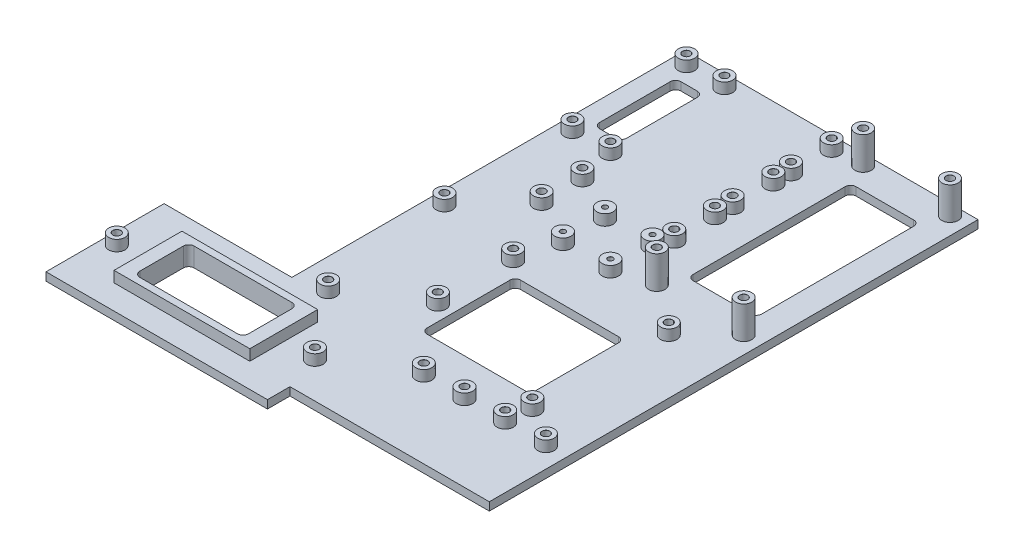
from build123d import *

# Parameters (mm, degrees)
SKETCH1_W                            = 155
SKETCH1_H                            = 180
BOSS_EXTRUDE1_DEPTH                  = 1
SKETCH2_W                            = 47.07
SKETCH2_H                            = 144.795
CUT_EXTRUDE1_DEPTH                   = 1
SKETCH3_W                            = 81.57
SKETCH3_H                            = 8.295
BOSS_EXTRUDE2_DEPTH                  = 1
SKETCH4_R                            = 3
BOSS_EXTRUDE3_DEPTH                  = 4
SKETCH5_R                            = 3
BOSS_EXTRUDE4_DEPTH                  = 8
BOSS_EXTRUDE5_DEPTH                  = 2
F_2_9_2_9_DIAMETER_HOLE2_AT_2_COUNT  = 2
F_2_9_2_9_DIAMETER_HOLE2_AT_2_PITCH  = 15
F_2_9_2_9_DIAMETER_HOLE2_AT_3_COUNT  = 2
F_2_9_2_9_DIAMETER_HOLE2_AT_3_PITCH  = 30
F_2_9_2_9_DIAMETER_HOLE2_AT_4_COUNT  = 2
F_2_9_2_9_DIAMETER_HOLE2_AT_4_PITCH  = 45
F_2_9_2_9_DIAMETER_HOLE2_AT_5_COUNT  = 2
F_2_9_2_9_DIAMETER_HOLE2_AT_5_PITCH  = 66.393302373
F_2_9_2_9_DIAMETER_HOLE2_AT_6_COUNT  = 2
F_2_9_2_9_DIAMETER_HOLE2_AT_6_PITCH  = 111.192522231
F_2_9_2_9_DIAMETER_HOLE2_AT_7_COUNT  = 2
F_2_9_2_9_DIAMETER_HOLE2_AT_7_PITCH  = 116.520457431
F_2_9_2_9_DIAMETER_HOLE2_AT_8_COUNT  = 2
F_2_9_2_9_DIAMETER_HOLE2_AT_8_PITCH  = 151.510187776
F_2_9_2_9_DIAMETER_HOLE2_AT_9_COUNT  = 2
F_2_9_2_9_DIAMETER_HOLE2_AT_9_PITCH  = 155.462461707
F_2_9_2_9_DIAMETER_HOLE2_AT_10_COUNT = 2
F_2_9_2_9_DIAMETER_HOLE2_AT_10_PITCH = 146.879821623
F_2_9_2_9_DIAMETER_HOLE2_AT_11_COUNT = 2
F_2_9_2_9_DIAMETER_HOLE2_AT_11_PITCH = 131.884350853
F_2_9_2_9_DIAMETER_HOLE2_AT_12_COUNT = 2
F_2_9_2_9_DIAMETER_HOLE2_AT_12_PITCH = 125.386650007
F_2_9_2_9_DIAMETER_HOLE2_AT_13_COUNT = 2
F_2_9_2_9_DIAMETER_HOLE2_AT_13_PITCH = 110.392988908
F_2_9_2_9_DIAMETER_HOLE2_AT_14_COUNT = 2
F_2_9_2_9_DIAMETER_HOLE2_AT_14_PITCH = 103.896304073
F_2_9_2_9_DIAMETER_HOLE2_AT_15_COUNT = 2
F_2_9_2_9_DIAMETER_HOLE2_AT_15_PITCH = 88.905804085
F_2_9_2_9_DIAMETER_HOLE2_AT_16_COUNT = 2
F_2_9_2_9_DIAMETER_HOLE2_AT_16_PITCH = 29.223387894
F_2_9_2_9_DIAMETER_HOLE2_AT_17_COUNT = 2
F_2_9_2_9_DIAMETER_HOLE2_AT_17_PITCH = 99.220393065
F_2_9_2_9_DIAMETER_HOLE2_AT_18_COUNT = 2
F_2_9_2_9_DIAMETER_HOLE2_AT_18_PITCH = 45.163969046
F_2_9_2_9_DIAMETER_HOLE2_AT_19_COUNT = 2
F_2_9_2_9_DIAMETER_HOLE2_AT_19_PITCH = 76.972060515
F_2_9_2_9_DIAMETER_HOLE2_AT_20_COUNT = 2
F_2_9_2_9_DIAMETER_HOLE2_AT_20_PITCH = 32.243202384
F_2_9_2_9_DIAMETER_HOLE2_AT_21_COUNT = 2
F_2_9_2_9_DIAMETER_HOLE2_AT_21_PITCH = 148.50139932
F_2_9_2_9_DIAMETER_HOLE2_AT_22_COUNT = 2
F_2_9_2_9_DIAMETER_HOLE2_AT_22_PITCH = 73.191431192
F_2_9_2_9_DIAMETER_HOLE2_AT_23_COUNT = 2
F_2_9_2_9_DIAMETER_HOLE2_AT_23_PITCH = 85.305249545
F_2_9_2_9_DIAMETER_HOLE2_AT_24_COUNT = 2
F_2_9_2_9_DIAMETER_HOLE2_AT_24_PITCH = 154.831087318
F_2_9_2_9_DIAMETER_HOLE2_AT_25_COUNT = 2
F_2_9_2_9_DIAMETER_HOLE2_AT_25_PITCH = 97.296127364
F_2_9_2_9_DIAMETER_HOLE2_AT_26_COUNT = 2
F_2_9_2_9_DIAMETER_HOLE2_AT_26_PITCH = 83.345884122
F_2_9_2_9_DIAMETER_HOLE2_AT_27_COUNT = 2
F_2_9_2_9_DIAMETER_HOLE2_AT_27_PITCH = 56.656355336
F_2_9_2_9_DIAMETER_HOLE2_AT_28_COUNT = 2
F_2_9_2_9_DIAMETER_HOLE2_AT_28_PITCH = 32.234455168
F_1_9_1_9_DIAMETER_HOLE1_D           = 1.9
F_1_9_1_9_DIAMETER_HOLE1_CSINK_D     = 1.95
F_1_9_1_9_DIAMETER_HOLE1_CSINK_ANGLE = 90
F_2_9_2_9_DIAMETER_HOLE1_D           = 2.9
F_2_9_2_9_DIAMETER_HOLE1_CSINK_D     = 2.95
F_2_9_2_9_DIAMETER_HOLE1_CSINK_ANGLE = 90
SKETCH18_W                           = 40
SKETCH18_H                           = 20
SKETCH18_H_2                         = 34.470588236
SKETCH18_W_2                         = 25.263157894
SKETCH18_H_3                         = 60
SKETCH18_W_3                         = 10
SKETCH18_H_4                         = 30
CUT_EXTRUDE2_DEPTH                   = 126.74639965
FILLET1_R                            = 2
SKETCH19_W                           = 50
SKETCH19_H                           = 25
BOSS_EXTRUDE6_DEPTH                  = 4
CUT_EXTRUDE3_DEPTH                   = 10


with BuildPart() as part:
    # Sketch1 → Boss-Extrude1 (new body)
    with BuildSketch(Plane(origin=(0, 0, 0), x_dir=(1, 0, 0), z_dir=(0, 1, 0))):
        Rectangle(SKETCH1_W, SKETCH1_H)
    extrude(amount=BOSS_EXTRUDE1_DEPTH)

    # Sketch2 → Cut-Extrude1 (cut)
    with BuildSketch(Plane(origin=(0, 1, 0), x_dir=(1, 0, 0), z_dir=(0, 1, 0))):
        with Locations((-53.965, 17.6025)):
            Rectangle(SKETCH2_W, SKETCH2_H)
    extrude(amount=-CUT_EXTRUDE1_DEPTH, mode=Mode.SUBTRACT)

    # Sketch3 → Boss-Extrude2 (add)
    with BuildSketch(Plane(origin=(0, 1, 0), x_dir=(1, 0, 0), z_dir=(0, 1, 0))):
        with Locations((-36.715, -94.1475)):
            Rectangle(SKETCH3_W, SKETCH3_H)
    extrude(amount=-BOSS_EXTRUDE2_DEPTH)

    # Sketch4 → Boss-Extrude3 (add)
    with BuildSketch(Plane(origin=(0, 1, 0), x_dir=(1, 0, 0), z_dir=(0, 1, 0))):
        with Locations(Location((-25.18, 85.295, 0), (0, 0, 270))):
            Circle(SKETCH4_R)
        with Locations(Location((-11.18, 85.295, 0), (0, 0, 270))):
            Circle(SKETCH4_R)
        with Locations(Location((-11.18, 43.295, 0), (0, 0, 270))):
            Circle(SKETCH4_R)
        with Locations(Location((-25.18, 43.295, 0), (0, 0, 270))):
            Circle(SKETCH4_R)
        with Locations(Location((-7.93, 29.705, 0), (0, 0, 270))):
            Circle(SKETCH4_R)
        with Locations(Location((-7.93, 14.705, 0), (0, 0, 270))):
            Circle(SKETCH4_R)
        with Locations(Location((0.07, -76.795, 0), (0, 0, 270))):
            Circle(SKETCH4_R)
        with Locations(Location((-72.93, -76.795, 0), (0, 0, 270))):
            Circle(SKETCH4_R)
        with Locations(Location((25.15, -61.795, 0), (0, 0, 270))):
            Circle(SKETCH4_R)
        with Locations(Location((40.15, -61.795, 0), (0, 0, 270))):
            Circle(SKETCH4_R)
        with Locations(Location((55.15, -61.795, 0), (0, 0, 270))):
            Circle(SKETCH4_R)
        with Locations(Location((70.15, -61.795, 0), (0, 0, 270))):
            Circle(SKETCH4_R)
        with Locations(Location((5.1, -8.805, 0), (0, 0, 270))):
            Circle(SKETCH4_R)
        with Locations(Location((5.1, -36.555, 0), (0, 0, 270))):
            Circle(SKETCH4_R)
        with Locations(Location((56.1, -52.755, 0), (0, 0, 270))):
            Circle(SKETCH4_R)
        with Locations(Location((57.3, -3.705, 0), (0, 0, 270))):
            Circle(SKETCH4_R)
        with Locations(Location((26.32, 5.795, 0), (0, 0, 270))):
            Circle(SKETCH4_R)
        with Locations(Location((8.82, 5.795, 0), (0, 0, 270))):
            Circle(SKETCH4_R)
        with Locations(Location((8.82, 21.295, 0), (0, 0, 270))):
            Circle(SKETCH4_R)
        with Locations(Location((26.32, 21.295, 0), (0, 0, 270))):
            Circle(SKETCH4_R)
        with Locations(Location((28.57, 27.045, 0), (0, 0, 270))):
            Circle(SKETCH4_R)
        with Locations(Location((28.57, 42.045, 0), (0, 0, 270))):
            Circle(SKETCH4_R)
        with Locations(Location((28.57, 48.545, 0), (0, 0, 270))):
            Circle(SKETCH4_R)
        with Locations(Location((28.57, 63.545, 0), (0, 0, 270))):
            Circle(SKETCH4_R)
        with Locations(Location((28.57, 70.045, 0), (0, 0, 270))):
            Circle(SKETCH4_R)
        with Locations(Location((28.57, 85.045, 0), (0, 0, 270))):
            Circle(SKETCH4_R)
        with Locations(Location((39.15, 86.045, 0), (0, 0, 270))):
            Circle(SKETCH4_R)
        with Locations(Location((71.15, 86.045, 0), (0, 0, 270))):
            Circle(SKETCH4_R)
        with Locations(Location((71.15, 10.045, 0), (0, 0, 270))):
            Circle(SKETCH4_R)
        with Locations(Location((39.15, 10.045, 0), (0, 0, 270))):
            Circle(SKETCH4_R)
        with Locations(Location((-25.35, -3.705, 0), (0, 0, 270))):
            Circle(SKETCH4_R)
        with Locations(Location((-19.1, -52.755, 0), (0, 0, 270))):
            Circle(SKETCH4_R)
    extrude(amount=BOSS_EXTRUDE3_DEPTH)

    # Sketch5 → Boss-Extrude4 (add)
    with BuildSketch(Plane(origin=(0, 5, 0), x_dir=(1, 0, 0), z_dir=(0, 1, 0))):
        with Locations(Location((71.15, 10.045, 0), (0, 0, 270))):
            Circle(SKETCH5_R)
        with Locations(Location((39.15, 10.045, 0), (0, 0, 270))):
            Circle(SKETCH5_R)
        with Locations(Location((39.15, 86.045, 0), (0, 0, 270))):
            Circle(SKETCH5_R)
        with Locations(Location((71.15, 86.045, 0), (0, 0, 270))):
            Circle(SKETCH5_R)
    extrude(amount=BOSS_EXTRUDE4_DEPTH)

    # Sketch6 → Boss-Extrude5 (add)
    with BuildSketch(Plane.XZ):
        Polygon((-77.5, 54.795), (-30.43, 54.795), (-30.43, -90), (77.5, -90), (77.5, 90), (4.07, 90), (4.07, 98.295), (-77.5, 98.295), align=None)
    extrude(amount=BOSS_EXTRUDE5_DEPTH)

    # Sketch12 → Ø2.9 (2.9) Diameter Hole2 (revolve, cut)
    with BuildSketch(Plane(origin=(25.15, 5, 61.795), x_dir=(0, 0, 1), z_dir=(1, 0, 0))):
        Polygon((0, 0), (0, 7), (1.45, 7), (1.45, 0.025), (1.475, 0), align=None)
    f_2_9_2_9_diameter_hole2 = revolve(axis=Axis((25.15, 11.35, 61.795), (0, -1, 0)), mode=Mode.SUBTRACT)

    # Ø2.9 (2.9) Diameter Hole2 at 2: Ø2.9 (2.9) Diameter Hole2 ×2
    with Locations(*[(i * F_2_9_2_9_DIAMETER_HOLE2_AT_2_PITCH, 0, 0) for i in range(1, F_2_9_2_9_DIAMETER_HOLE2_AT_2_COUNT)]):
        add(f_2_9_2_9_diameter_hole2, mode=Mode.SUBTRACT)

    # Ø2.9 (2.9) Diameter Hole2 at 3: Ø2.9 (2.9) Diameter Hole2 ×2
    with Locations(*[(i * F_2_9_2_9_DIAMETER_HOLE2_AT_3_PITCH, 0, 0) for i in range(1, F_2_9_2_9_DIAMETER_HOLE2_AT_3_COUNT)]):
        add(f_2_9_2_9_diameter_hole2, mode=Mode.SUBTRACT)

    # Ø2.9 (2.9) Diameter Hole2 at 4: Ø2.9 (2.9) Diameter Hole2 ×2
    with Locations(*[(i * F_2_9_2_9_DIAMETER_HOLE2_AT_4_PITCH, 0, 0) for i in range(1, F_2_9_2_9_DIAMETER_HOLE2_AT_4_COUNT)]):
        add(f_2_9_2_9_diameter_hole2, mode=Mode.SUBTRACT)

    # Ø2.9 (2.9) Diameter Hole2 at 5: Ø2.9 (2.9) Diameter Hole2 ×2
    with Locations(*[Vector(0.48423559080332107, 0, -0.8749376506925272) * (i * F_2_9_2_9_DIAMETER_HOLE2_AT_5_PITCH) for i in range(1, F_2_9_2_9_DIAMETER_HOLE2_AT_5_COUNT)]):
        add(f_2_9_2_9_diameter_hole2, mode=Mode.SUBTRACT)

    # Ø2.9 (2.9) Diameter Hole2 at 6: Ø2.9 (2.9) Diameter Hole2 ×2
    with Locations(*[Vector(-0.3267306044615087, 0, -0.9451175123275503) * (i * F_2_9_2_9_DIAMETER_HOLE2_AT_6_PITCH) for i in range(1, F_2_9_2_9_DIAMETER_HOLE2_AT_6_COUNT)]):
        add(f_2_9_2_9_diameter_hole2, mode=Mode.SUBTRACT)

    # Ø2.9 (2.9) Diameter Hole2 at 7: Ø2.9 (2.9) Diameter Hole2 ×2
    with Locations(*[Vector(-0.4319413183704097, 0, -0.9019017116540097) * (i * F_2_9_2_9_DIAMETER_HOLE2_AT_7_PITCH) for i in range(1, F_2_9_2_9_DIAMETER_HOLE2_AT_7_COUNT)]):
        add(f_2_9_2_9_diameter_hole2, mode=Mode.SUBTRACT)

    # Ø2.9 (2.9) Diameter Hole2 at 8: Ø2.9 (2.9) Diameter Hole2 ×2
    with Locations(*[Vector(-0.23978585554687462, 0, -0.9708258049102596) * (i * F_2_9_2_9_DIAMETER_HOLE2_AT_8_PITCH) for i in range(1, F_2_9_2_9_DIAMETER_HOLE2_AT_8_COUNT)]):
        add(f_2_9_2_9_diameter_hole2, mode=Mode.SUBTRACT)

    # Ø2.9 (2.9) Diameter Hole2 at 9: Ø2.9 (2.9) Diameter Hole2 ×2
    with Locations(*[Vector(-0.3237437478306334, 0, -0.9461448016770876) * (i * F_2_9_2_9_DIAMETER_HOLE2_AT_9_PITCH) for i in range(1, F_2_9_2_9_DIAMETER_HOLE2_AT_9_COUNT)]):
        add(f_2_9_2_9_diameter_hole2, mode=Mode.SUBTRACT)

    # Ø2.9 (2.9) Diameter Hole2 at 10: Ø2.9 (2.9) Diameter Hole2 ×2
    with Locations(*[Vector(0.023284342002936977, 0, -0.9997288829565195) * (i * F_2_9_2_9_DIAMETER_HOLE2_AT_10_PITCH) for i in range(1, F_2_9_2_9_DIAMETER_HOLE2_AT_10_COUNT)]):
        add(f_2_9_2_9_diameter_hole2, mode=Mode.SUBTRACT)

    # Ø2.9 (2.9) Diameter Hole2 at 11: Ø2.9 (2.9) Diameter Hole2 ×2
    with Locations(*[Vector(0.025931810543646808, 0, -0.9996637140568465) * (i * F_2_9_2_9_DIAMETER_HOLE2_AT_11_PITCH) for i in range(1, F_2_9_2_9_DIAMETER_HOLE2_AT_11_COUNT)]):
        add(f_2_9_2_9_diameter_hole2, mode=Mode.SUBTRACT)

    # Ø2.9 (2.9) Diameter Hole2 at 12: Ø2.9 (2.9) Diameter Hole2 ×2
    with Locations(*[Vector(0.027275631016592573, 0, -0.9996279507660071) * (i * F_2_9_2_9_DIAMETER_HOLE2_AT_12_PITCH) for i in range(1, F_2_9_2_9_DIAMETER_HOLE2_AT_12_COUNT)]):
        add(f_2_9_2_9_diameter_hole2, mode=Mode.SUBTRACT)

    # Ø2.9 (2.9) Diameter Hole2 at 13: Ø2.9 (2.9) Diameter Hole2 ×2
    with Locations(*[Vector(0.030980228308303416, 0, -0.9995199975257951) * (i * F_2_9_2_9_DIAMETER_HOLE2_AT_13_PITCH) for i in range(1, F_2_9_2_9_DIAMETER_HOLE2_AT_13_COUNT)]):
        add(f_2_9_2_9_diameter_hole2, mode=Mode.SUBTRACT)

    # Ø2.9 (2.9) Diameter Hole2 at 14: Ø2.9 (2.9) Diameter Hole2 ×2
    with Locations(*[Vector(0.032917436577932876, 0, -0.9994580743428599) * (i * F_2_9_2_9_DIAMETER_HOLE2_AT_14_PITCH) for i in range(1, F_2_9_2_9_DIAMETER_HOLE2_AT_14_COUNT)]):
        add(f_2_9_2_9_diameter_hole2, mode=Mode.SUBTRACT)

    # Ø2.9 (2.9) Diameter Hole2 at 15: Ø2.9 (2.9) Diameter Hole2 ×2
    with Locations(*[Vector(0.03846767975609684, 0, -0.9992598448922995) * (i * F_2_9_2_9_DIAMETER_HOLE2_AT_15_PITCH) for i in range(1, F_2_9_2_9_DIAMETER_HOLE2_AT_15_COUNT)]):
        add(f_2_9_2_9_diameter_hole2, mode=Mode.SUBTRACT)

    # Ø2.9 (2.9) Diameter Hole2 at 16: Ø2.9 (2.9) Diameter Hole2 ×2
    with Locations(*[Vector(-0.858216716385444, 0, 0.5132875097999041) * (i * F_2_9_2_9_DIAMETER_HOLE2_AT_16_PITCH) for i in range(1, F_2_9_2_9_DIAMETER_HOLE2_AT_16_COUNT)]):
        add(f_2_9_2_9_diameter_hole2, mode=Mode.SUBTRACT)

    # Ø2.9 (2.9) Diameter Hole2 at 17: Ø2.9 (2.9) Diameter Hole2 ×2
    with Locations(*[Vector(-0.988506464952352, 0, 0.15117859884059154) * (i * F_2_9_2_9_DIAMETER_HOLE2_AT_17_PITCH) for i in range(1, F_2_9_2_9_DIAMETER_HOLE2_AT_17_COUNT)]):
        add(f_2_9_2_9_diameter_hole2, mode=Mode.SUBTRACT)

    # Ø2.9 (2.9) Diameter Hole2 at 18: Ø2.9 (2.9) Diameter Hole2 ×2
    with Locations(*[Vector(-0.9797633143092743, 0, -0.20015955618882234) * (i * F_2_9_2_9_DIAMETER_HOLE2_AT_18_PITCH) for i in range(1, F_2_9_2_9_DIAMETER_HOLE2_AT_18_COUNT)]):
        add(f_2_9_2_9_diameter_hole2, mode=Mode.SUBTRACT)

    # Ø2.9 (2.9) Diameter Hole2 at 19: Ø2.9 (2.9) Diameter Hole2 ×2
    with Locations(*[Vector(-0.656082215570137, 0, -0.7546894238112658) * (i * F_2_9_2_9_DIAMETER_HOLE2_AT_19_PITCH) for i in range(1, F_2_9_2_9_DIAMETER_HOLE2_AT_19_COUNT)]):
        add(f_2_9_2_9_diameter_hole2, mode=Mode.SUBTRACT)

    # Ø2.9 (2.9) Diameter Hole2 at 20: Ø2.9 (2.9) Diameter Hole2 ×2
    with Locations(*[Vector(0.9598922473964604, 0, -0.2803691733913921) * (i * F_2_9_2_9_DIAMETER_HOLE2_AT_20_PITCH) for i in range(1, F_2_9_2_9_DIAMETER_HOLE2_AT_20_COUNT)]):
        add(f_2_9_2_9_diameter_hole2, mode=Mode.SUBTRACT)

    # Ø2.9 (2.9) Diameter Hole2 at 21: Ø2.9 (2.9) Diameter Hole2 ×2
    with Locations(*[Vector(0.09427520591796769, 0, -0.9955461744937424) * (i * F_2_9_2_9_DIAMETER_HOLE2_AT_21_PITCH) for i in range(1, F_2_9_2_9_DIAMETER_HOLE2_AT_21_COUNT)]):
        add(f_2_9_2_9_diameter_hole2, mode=Mode.SUBTRACT)

    # Ø2.9 (2.9) Diameter Hole2 at 22: Ø2.9 (2.9) Diameter Hole2 ×2
    with Locations(*[Vector(0.19127922178741333, 0, -0.9815356638005578) * (i * F_2_9_2_9_DIAMETER_HOLE2_AT_22_PITCH) for i in range(1, F_2_9_2_9_DIAMETER_HOLE2_AT_22_COUNT)]):
        add(f_2_9_2_9_diameter_hole2, mode=Mode.SUBTRACT)

    # Ø2.9 (2.9) Diameter Hole2 at 23: Ø2.9 (2.9) Diameter Hole2 ×2
    with Locations(*[Vector(0.5392399675887218, 0, -0.8421521580776922) * (i * F_2_9_2_9_DIAMETER_HOLE2_AT_23_PITCH) for i in range(1, F_2_9_2_9_DIAMETER_HOLE2_AT_23_COUNT)]):
        add(f_2_9_2_9_diameter_hole2, mode=Mode.SUBTRACT)

    # Ø2.9 (2.9) Diameter Hole2 at 24: Ø2.9 (2.9) Diameter Hole2 ×2
    with Locations(*[Vector(0.2970979587942434, 0, -0.9548470049595873) * (i * F_2_9_2_9_DIAMETER_HOLE2_AT_24_PITCH) for i in range(1, F_2_9_2_9_DIAMETER_HOLE2_AT_24_COUNT)]):
        add(f_2_9_2_9_diameter_hole2, mode=Mode.SUBTRACT)

    # Ø2.9 (2.9) Diameter Hole2 at 25: Ø2.9 (2.9) Diameter Hole2 ×2
    with Locations(*[Vector(-0.33999297707192394, 0, -0.9404279746699213) * (i * F_2_9_2_9_DIAMETER_HOLE2_AT_25_PITCH) for i in range(1, F_2_9_2_9_DIAMETER_HOLE2_AT_25_COUNT)]):
        add(f_2_9_2_9_diameter_hole2, mode=Mode.SUBTRACT)

    # Ø2.9 (2.9) Diameter Hole2 at 26: Ø2.9 (2.9) Diameter Hole2 ×2
    with Locations(*[Vector(-0.39690022307236633, 0, -0.917861761337243) * (i * F_2_9_2_9_DIAMETER_HOLE2_AT_26_PITCH) for i in range(1, F_2_9_2_9_DIAMETER_HOLE2_AT_26_COUNT)]):
        add(f_2_9_2_9_diameter_hole2, mode=Mode.SUBTRACT)

    # Ø2.9 (2.9) Diameter Hole2 at 27: Ø2.9 (2.9) Diameter Hole2 ×2
    with Locations(*[Vector(-0.35388792450495815, 0, -0.9352878363849138) * (i * F_2_9_2_9_DIAMETER_HOLE2_AT_27_PITCH) for i in range(1, F_2_9_2_9_DIAMETER_HOLE2_AT_27_COUNT)]):
        add(f_2_9_2_9_diameter_hole2, mode=Mode.SUBTRACT)

    # Ø2.9 (2.9) Diameter Hole2 at 28: Ø2.9 (2.9) Diameter Hole2 ×2
    with Locations(*[Vector(-0.6220052392785671, 0, -0.7830130792713571) * (i * F_2_9_2_9_DIAMETER_HOLE2_AT_28_PITCH) for i in range(1, F_2_9_2_9_DIAMETER_HOLE2_AT_28_COUNT)]):
        add(f_2_9_2_9_diameter_hole2, mode=Mode.SUBTRACT)

    # Ø1.9 (1.9) Diameter Hole1 (through all)
    with Locations(Plane(origin=(0, 5, 0), x_dir=(1, 0, 0), z_dir=(0, 1, 0))):
        with Locations((8.82, 21.295), (26.32, 21.295), (26.32, 5.795), (8.82, 5.795)):
            CounterSinkHole(F_1_9_1_9_DIAMETER_HOLE1_D / 2, F_1_9_1_9_DIAMETER_HOLE1_CSINK_D / 2, counter_sink_angle=F_1_9_1_9_DIAMETER_HOLE1_CSINK_ANGLE)

    # Ø2.9 (2.9) Diameter Hole1 (through all)
    with Locations(Plane(origin=(0, 13, 0), x_dir=(1, 0, 0), z_dir=(0, 1, 0))):
        with Locations((71.15, 86.045), (39.15, 86.045), (39.15, 10.045), (71.15, 10.045)):
            CounterSinkHole(F_2_9_2_9_DIAMETER_HOLE1_D / 2, F_2_9_2_9_DIAMETER_HOLE1_CSINK_D / 2, counter_sink_angle=F_2_9_2_9_DIAMETER_HOLE1_CSINK_ANGLE)

    # Sketch18 → Cut-Extrude2 (cut, through all)
    with BuildSketch(Plane(origin=(0, 1, 0), x_dir=(1, 0, 0), z_dir=(0, 1, 0))):
        with Locations((-36.43, -76.795)):
            Rectangle(SKETCH18_W, SKETCH18_H)
        with Locations((30.6, -30.78)):
            Rectangle(SKETCH18_W, SKETCH18_H_2)
        with Locations((55.15, 48.045)):
            Rectangle(SKETCH18_W_2, SKETCH18_H_3)
        with Locations((-18.18, 64.295)):
            Rectangle(SKETCH18_W_3, SKETCH18_H_4)
    extrude(amount=-CUT_EXTRUDE2_DEPTH, mode=Mode.SUBTRACT)

    # Fillet1
    fillet1_edges = [part.edges().sort_by_distance(p)[0] for p in [
        (-16.43, -0.5, 66.795),
        (-16.43, -0.5, 86.795),
        (-56.43, -0.5, 86.795),
        (-56.43, -0.5, 66.795),
        (50.6, -0.5, 13.544705882),
        (50.6, -0.5, 48.015294118),
        (10.6, -0.5, 48.015294118),
        (10.6, -0.5, 13.544705882),
        (67.781578947, -0.5, -78.045),
        (67.781578947, -0.5, -18.045),
        (42.518421053, -0.5, -18.045),
        (42.518421053, -0.5, -78.045),
        (-13.18, -0.5, -79.295),
        (-13.18, -0.5, -49.295),
        (-23.18, -0.5, -49.295),
        (-23.18, -0.5, -79.295),
    ]]
    fillet(fillet1_edges, radius=FILLET1_R)

    # Sketch19 → Boss-Extrude6 (add)
    with BuildSketch(Plane(origin=(0, 1, 0), x_dir=(1, 0, 0), z_dir=(0, 1, 0))):
        with Locations((-36.43, -76.795)):
            Rectangle(SKETCH19_W, SKETCH19_H)
    extrude(amount=BOSS_EXTRUDE6_DEPTH)

    # Sketch20 → Cut-Extrude3 (cut)
    with BuildSketch(Plane.XZ.offset(-1)):
        with BuildLine():
            Line((-56.43, 84.795), (-56.43, 68.795))
            ThreePointArc((-56.43, 68.795), (-55.844213562, 67.380786438), (-54.43, 66.795))
            Line((-54.43, 66.795), (-18.43, 66.795))
            ThreePointArc((-18.43, 66.795), (-17.015786438, 67.380786438), (-16.43, 68.795))
            Line((-16.43, 68.795), (-16.43, 84.795))
            ThreePointArc((-16.43, 84.795), (-17.015786438, 86.209213562), (-18.43, 86.795))
            Line((-18.43, 86.795), (-54.43, 86.795))
            ThreePointArc((-54.43, 86.795), (-55.844213562, 86.209213562), (-56.43, 84.795))
        make_face()
    extrude(amount=-CUT_EXTRUDE3_DEPTH, mode=Mode.SUBTRACT)


solid = part.part
